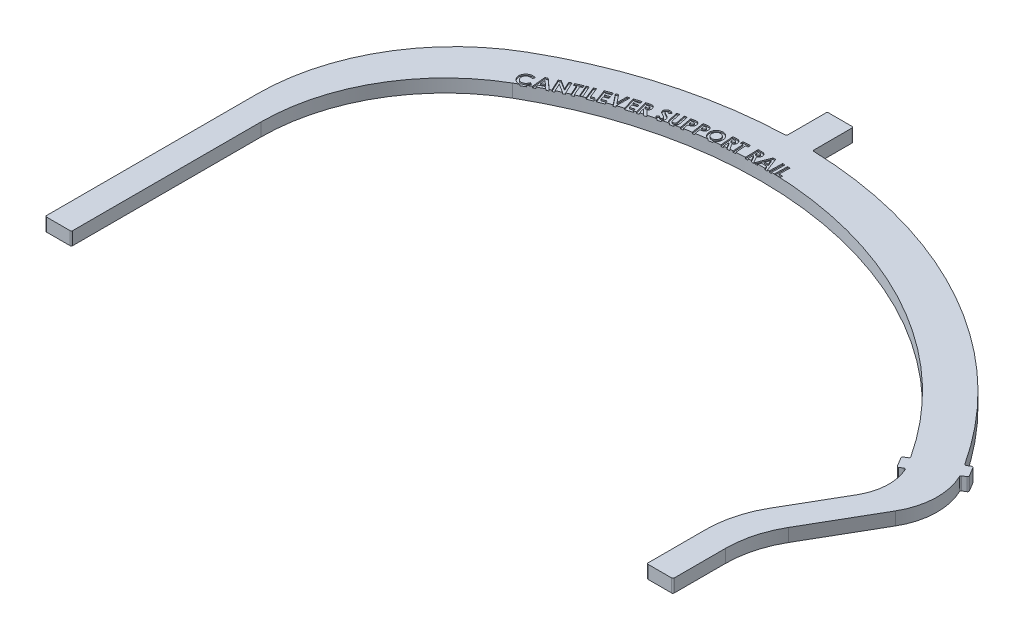
from build123d import *

# Parameters (mm, degrees)
BOSS_EXTRUDE1_DEPTH = 12.7
FILLET1_R           = 1.27
CUT_EXTRUDE1_DEPTH  = 1.27


with BuildPart() as part:
    # Sketch1 → Boss-Extrude1 (new body)
    with BuildSketch(Plane(origin=(0, 0, 0), x_dir=(1, 0, 0), z_dir=(0, 1, 0))):
        with BuildLine():
            Line((12.7, 417.636946282), (12.7, 457.2))
            Line((12.7, 457.2), (-12.7, 457.2))
            Line((-12.7, 457.2), (-12.7, 417.636946282))
            ThreePointArc((-12.7, 417.636946282), (-114.264207012, 401.902475603), (-208.915, 361.851394463))
            ThreePointArc((-208.915, 361.851394463), (-279.107691684, 291.65870278), (-304.8, 195.77370278))
            Line((-304.8, 195.77370278), (-304.8, -10.16))
            Line((-304.8, -10.16), (-279.4, -10.16))
            Line((-279.4, -10.16), (-279.4, 173.776657523))
            ThreePointArc((-279.4, 173.776657523), (-255.409169056, 263.311657523), (-189.865, 328.855826579))
            ThreePointArc((-189.865, 328.855826579), (88.781385623, 369.205550428), (318.619726062, 206.582533299))
            Line((318.619726062, 206.582533299), (313.181667761, 203.303810694))
            Line((313.181667761, 203.303810694), (319.739112972, 192.427694094))
            Line((319.739112972, 192.427694094), (325.177171273, 195.706416699))
            ThreePointArc((325.177171273, 195.706416699), (330.124805237, 172.660298346), (323.643063584, 149.997781316))
            Line((323.643063584, 149.997781316), (292.47627178, 96.015314403))
            ThreePointArc((292.47627178, 96.015314403), (282.725728673, 72.475420994), (279.4, 47.214003746))
            Line((279.4, 47.214003746), (279.4, -10.16))
            Line((279.4, -10.16), (304.8, -10.16))
            Line((304.8, -10.16), (304.8, 40.64))
            ThreePointArc((304.8, 40.64), (308.096238021, 65.677413503), (317.760318909, 89.008568651))
            Line((317.760318909, 89.008568651), (355.860318909, 154.99970442))
            ThreePointArc((355.860318909, 154.99970442), (364.399518175, 185.242382465), (357.491909189, 215.898906038))
            Line((357.491909189, 215.898906038), (362.929967489, 219.177628643))
            Line((362.929967489, 219.177628643), (356.372522278, 230.053745244))
            Line((356.372522278, 230.053745244), (350.934463978, 226.775022638))
            ThreePointArc((350.934463978, 226.775022638), (205.340142988, 363.891927057), (12.7, 417.636946282))
        make_face()
    extrude(amount=BOSS_EXTRUDE1_DEPTH)

    # Fillet1
    fillet1_edges = [part.edges().sort_by_distance(p)[0] for p in [
        (-279.4, 6.35, 10.16),
        (-304.8, 6.35, 10.16),
        (-12.7, 6.35, -417.636946282),
        (-12.7, 6.35, -457.2),
        (12.7, 6.35, -457.2),
        (12.7, 6.35, -417.636946282),
        (350.934463978, 6.35, -226.775022638),
        (356.372522278, 6.35, -230.053745244),
        (362.929967489, 6.35, -219.177628643),
        (357.491909189, 6.35, -215.898906038),
        (304.8, 6.35, 10.16),
        (279.4, 6.35, 10.16),
        (325.177171273, 6.35, -195.706416699),
        (319.739112972, 6.35, -192.427694094),
        (313.181667761, 6.35, -203.303810694),
        (318.619726062, 6.35, -206.582533299),
    ]]
    fillet(fillet1_edges, radius=FILLET1_R)

    # Sketch2 → Cut-Extrude1 (cut)
    # profile 1 of 21: a face of its own
    with BuildSketch(Plane(origin=(0, 12.7, 0), x_dir=(1, 0, 0), z_dir=(0, 1, 0))):
        with BuildLine():
            Line((-183.436133814, 344.349216002), (-184.138297276, 342.118066162))
            add(Edge.make_bspline(
                [(-184.138297276, 342.118066162), (-184.334208247, 342.174776719), (-184.717447153, 342.285713291), (-185.293816958, 342.393164695), (-185.854500385, 342.442572779), (-186.400124144, 342.435519598), (-186.930865296, 342.372499098), (-187.445150299, 342.25188818), (-187.944411901, 342.076670827), (-188.25877982, 341.916502439), (-188.417423878, 341.835674335)],
                knots=[0, 0, 0, 0, 1.108668656, 2.168765531, 3.182528913, 4.164925455, 5.131069748, 6.083032415, 7.032612752, 8, 8, 8, 8], degree=3))
            add(Edge.make_bspline(
                [(-188.417423878, 341.835674335), (-188.546107628, 341.759960844), (-188.798674867, 341.611358184), (-189.147549449, 341.351715891), (-189.460646776, 341.066641908), (-189.741194255, 340.756339827), (-189.985399108, 340.420008556), (-190.195180584, 340.058272654), (-190.371810553, 339.672678564), (-190.509357898, 339.265619422), (-190.612010909, 338.847901197), (-190.670505642, 338.427652985), (-190.686738191, 338.010712011), (-190.657097585, 337.59752516), (-190.589985535, 337.185906126), (-190.472680505, 336.778769558), (-190.318539427, 336.372976284), (-190.18317029, 336.113660927), (-190.11431891, 335.981768085)],
                knots=[0, 0, 0, 0, 1.053669127, 2.068033471, 3.064135552, 4.03930225, 5.016635864, 5.99332725, 6.987429577, 8.006185167, 9.022809227, 10.020368059, 10.997059445, 11.963361478, 12.940878509, 13.936116325, 14.950268562, 16, 16, 16, 16], degree=3))
            add(Edge.make_bspline(
                [(-190.11431891, 335.981768085), (-190.063087464, 335.891040779), (-189.961984562, 335.71199461), (-189.788365539, 335.460444721), (-189.610805994, 335.220827804), (-189.416661259, 335.001600376), (-189.217406645, 334.793864401), (-189.002209291, 334.606242361), (-188.778171846, 334.432567752), (-188.544545064, 334.275201664), (-188.303013295, 334.134351221), (-188.052374928, 334.014825833), (-187.79621167, 333.913790833), (-187.534774942, 333.82853928), (-187.266889504, 333.762723145), (-186.992511217, 333.713703657), (-186.711767571, 333.686669412), (-186.331918014, 333.672801449), (-185.852950613, 333.701924676), (-185.285063146, 333.81664501), (-184.723908573, 334.000731594), (-184.371030557, 334.182390491), (-184.191722756, 334.274696771)],
                knots=[0, 0, 0, 0, 0.904477809, 1.784945369, 2.652596305, 3.493060883, 4.32642761, 5.150959464, 5.970078434, 6.787208121, 7.595728123, 8.396257636, 9.196380444, 9.985992823, 10.782718355, 11.590399209, 12.404635804, 13.230088261, 14.890511674, 16.557440406, 18.250733226, 20, 20, 20, 20], degree=3))
            add(Edge.make_bspline(
                [(-184.191722756, 334.274696771), (-184.043919464, 334.361604334), (-183.752580101, 334.532910355), (-183.355515841, 334.837445219), (-183.001049053, 335.172823675), (-182.74041744, 335.481036542), (-182.554035437, 335.751032106), (-182.415775744, 335.971336514), (-182.287684677, 336.21524771), (-182.158900993, 336.476049013), (-182.042024594, 336.759753216), (-181.922247667, 337.060144608), (-181.814991558, 337.383999065), (-181.746438788, 337.607301899), (-181.711254006, 337.721912316)],
                knots=[0, 0, 0, 0, 1.409382844, 2.778075459, 4.105398876, 5.417456718, 6.088945294, 6.803238793, 7.5553943, 8.354082489, 9.194945576, 10.078421385, 11.013747733, 12, 12, 12, 12], degree=3))
            Line((-181.711254006, 337.721912316), (-179.449575321, 337.019748855))
            add(Edge.make_bspline(
                [(-179.449575321, 337.019748855), (-179.497711614, 336.866756894), (-179.59182042, 336.567650135), (-179.747428288, 336.134978907), (-179.909966838, 335.72750249), (-180.079881837, 335.344836793), (-180.260066115, 334.987785061), (-180.451684547, 334.657974849), (-180.646585841, 334.350313031), (-180.85483075, 334.067920645), (-181.077046325, 333.80403857), (-181.310557025, 333.54771448), (-181.565595589, 333.304023906), (-181.838931057, 333.070867784), (-182.126200971, 332.842076474), (-182.435209323, 332.62836049), (-182.75801445, 332.416745711), (-182.985047371, 332.2890232), (-183.100316506, 332.224175938)],
                knots=[0, 0, 0, 0, 1.239492818, 2.423269025, 3.552726668, 4.629475398, 5.658320836, 6.641999771, 7.576499069, 8.471839977, 9.351302899, 10.241905312, 11.150462914, 12.075351284, 13.018111434, 13.987294112, 14.978109132, 16, 16, 16, 16], degree=3))
            add(Edge.make_bspline(
                [(-183.100316506, 332.224175938), (-183.314761457, 332.112655985), (-183.734970966, 331.894130231), (-184.384153411, 331.637211849), (-185.031771167, 331.445531867), (-185.679965736, 331.326193793), (-186.326811006, 331.271898923), (-186.972354171, 331.284126227), (-187.617042971, 331.36647788), (-188.253957248, 331.517041623), (-188.873646914, 331.72590881), (-189.461740515, 331.998255257), (-190.016914659, 332.323550253), (-190.533699784, 332.71128822), (-191.013718279, 333.15629234), (-191.456673002, 333.659067396), (-191.870988799, 334.21384858), (-192.106068227, 334.619820338), (-192.225897436, 334.826760073)],
                knots=[0, 0, 0, 0, 1.089117141, 2.134148544, 3.141927206, 4.12948818, 5.100067623, 6.063687251, 7.034853834, 8.024336998, 9.009675401, 9.977887629, 10.941082454, 11.905278301, 12.88462788, 13.886639386, 14.922737172, 16, 16, 16, 16], degree=3))
            add(Edge.make_bspline(
                [(-192.225897436, 334.826760073), (-192.298637994, 334.965081838), (-192.442244958, 335.238161525), (-192.628718062, 335.655384409), (-192.781534574, 336.075042346), (-192.906379971, 336.495577368), (-193.004815088, 336.917398095), (-193.067064369, 337.342133183), (-193.1037708, 337.766937013), (-193.108749561, 338.192951393), (-193.082843925, 338.617046884), (-193.029387742, 339.037747367), (-192.948043547, 339.454506132), (-192.835969968, 339.86579595), (-192.694510247, 340.272387345), (-192.527308489, 340.675184333), (-192.32741216, 341.071948736), (-192.102353517, 341.462428558), (-191.851561189, 341.839616659), (-191.579004374, 342.199201933), (-191.285741237, 342.53816163), (-190.973034396, 342.856931073), (-190.638168703, 343.152644268), (-190.283683278, 343.427647737), (-189.909577496, 343.683704706), (-189.646406884, 343.8353119), (-189.513918269, 343.911635874)],
                knots=[0, 0, 0, 0, 1.063353785, 2.099310389, 3.107092255, 4.10039494, 5.083147309, 6.05192315, 7.019047492, 7.982860345, 8.948330362, 9.908213332, 10.866829083, 11.835587735, 12.806509757, 13.794669332, 14.801194653, 15.827656348, 16.860022271, 17.881491522, 18.896156572, 19.908192441, 20.917971633, 21.933801203, 22.959808568, 24, 24, 24, 24], degree=3))
            add(Edge.make_bspline(
                [(-189.513918269, 343.911635874), (-189.399382948, 343.973455773), (-189.171221021, 344.096605098), (-188.815177741, 344.25239419), (-188.454258643, 344.393612304), (-188.085420719, 344.5129133), (-187.710533052, 344.611225499), (-187.330036439, 344.695237897), (-186.941212323, 344.751212961), (-186.547512883, 344.792847872), (-186.150910787, 344.813704872), (-185.755137463, 344.810491615), (-185.362002115, 344.787581302), (-184.971143679, 344.744825166), (-184.583193991, 344.678190922), (-184.196656278, 344.591436701), (-183.813465773, 344.482936159), (-183.562039935, 344.393835033), (-183.436133814, 344.349216002)],
                knots=[0, 0, 0, 0, 0.993707947, 1.97953189, 2.96586638, 3.953157434, 4.938236355, 5.92533617, 6.927473271, 7.936764488, 8.948525925, 9.958980351, 10.958161691, 11.955262473, 12.960471858, 13.963006587, 14.979938019, 16, 16, 16, 16], degree=3))
        make_face()
    # profile 2 of 21: a face of its own
    with BuildSketch(Plane(origin=(0, 12.7, 0), x_dir=(1, 0, 0), z_dir=(0, 1, 0))):
        Polygon((-178.922355153, 349.103141408), (-176.754807076, 350.207268011), (-166.710816691, 341.183449902), (-168.931790249, 340.051338524), (-170.987399223, 341.91614221), (-175.566726146, 339.580685479), (-175.304686884, 336.802560479), (-177.525660441, 335.670449101), align=None)
        Polygon((-176.304506595, 346.686274421), (-175.836397621, 342.068786441), (-172.852202909, 343.590140607), align=None, mode=Mode.SUBTRACT)
    # profile 3 of 21: a face of its own
    with BuildSketch(Plane(origin=(0, 12.7, 0), x_dir=(1, 0, 0), z_dir=(0, 1, 0))):
        Polygon((-170.314195296, 353.457642666), (-168.228057475, 354.432021673), (-159.794463725, 349.181060134), (-163.310369174, 356.724229205), (-161.130100745, 357.73931334), (-155.787552668, 346.278275679), (-157.88386677, 345.301352602), (-166.294563886, 350.531961577), (-162.791378789, 343.014233211), (-164.971647219, 341.996605006), align=None)
    # profile 4 of 21: a face of its own
    with BuildSketch(Plane(origin=(0, 12.7, 0), x_dir=(1, 0, 0), z_dir=(0, 1, 0))):
        Polygon((-159.340600838, 358.54246818), (-152.942263498, 361.325681321), (-151.995869268, 359.153045103), (-154.104903723, 358.234635648), (-150.014038338, 348.829206962), (-152.247732248, 347.857372026), (-156.338597633, 357.262800712), (-158.394206607, 356.369831962), align=None)
    # profile 5 of 21: a face of its own
    with BuildSketch(Plane(origin=(0, 12.7, 0), x_dir=(1, 0, 0), z_dir=(0, 1, 0))):
        Polygon((-151.634667131, 361.885834877), (-149.44676649, 362.837317249), (-144.409506875, 351.259252345), (-146.597407516, 350.307769974), align=None)
    # profile 6 of 21: a face of its own
    with BuildSketch(Plane(origin=(0, 12.7, 0), x_dir=(1, 0, 0), z_dir=(0, 1, 0))):
        Polygon((-146.545744901, 363.897365784), (-144.319683202, 364.777614182), (-140.529018138, 355.204276842), (-137.285328234, 356.489032451), (-136.445784965, 354.367277643), (-141.915536567, 352.202273637), align=None)
    # profile 7 of 21: a face of its own
    with BuildSketch(Plane(origin=(0, 12.7, 0), x_dir=(1, 0, 0), z_dir=(0, 1, 0))):
        Polygon((-138.997336809, 366.860338773), (-132.548118059, 369.246676914), (-131.734015495, 367.04605592), (-135.949540335, 365.486540696), (-135.158334405, 363.349521465), (-130.942809565, 364.909036689), (-130.143971424, 362.749120824), (-134.359496264, 361.1896056), (-133.209576392, 358.083295503), (-128.994051552, 359.642810728), (-128.177404918, 357.434557523), (-134.626623668, 355.048219382), align=None)
    # profile 8 of 21: a face of its own
    with BuildSketch(Plane(origin=(0, 12.7, 0), x_dir=(1, 0, 0), z_dir=(0, 1, 0))):
        Polygon((-131.013741447, 369.793766237), (-128.678284716, 370.582428096), (-122.811658113, 363.123213352), (-122.638661318, 372.627860788), (-120.303204588, 373.419066718), (-120.56269978, 360.03471175), (-122.753144491, 359.294387231), align=None)
    # profile 9 of 21: a face of its own
    with BuildSketch(Plane(origin=(0, 12.7, 0), x_dir=(1, 0, 0), z_dir=(0, 1, 0))):
        Polygon((-118.029573282, 374.142448137), (-111.453151006, 376.164984195), (-110.763707897, 373.921114003), (-115.063187064, 372.600741407), (-114.394096519, 370.423017048), (-110.094617352, 371.743389644), (-109.415350525, 369.54022458), (-113.714829692, 368.219851984), (-112.740450686, 365.049940125), (-108.440971519, 366.370312721), (-107.748984339, 364.118810317), (-114.325406615, 362.096274259), align=None)
    # profile 10 of 21: a face of its own
    with BuildSketch(Plane(origin=(0, 12.7, 0), x_dir=(1, 0, 0), z_dir=(0, 1, 0))):
        with BuildLine():
            Line((-108.841255093, 376.941196229), (-106.386227048, 377.625551197))
            add(Edge.make_bspline(
                [(-106.386227048, 377.625551197), (-106.223584659, 377.669467283), (-105.911020777, 377.753864605), (-105.456880893, 377.865051895), (-105.034844053, 377.950835558), (-104.646556788, 378.018562997), (-104.29073504, 378.062362721), (-103.96893946, 378.085746536), (-103.678941448, 378.090832396), (-103.417777272, 378.069647033), (-103.176333461, 378.0307414), (-102.945279667, 377.975182887), (-102.722382613, 377.897749129), (-102.504291034, 377.806094), (-102.293159841, 377.696632015), (-102.087848149, 377.568546421), (-101.890881978, 377.420711218), (-101.698974045, 377.257483693), (-101.517100157, 377.078717364), (-101.349077529, 376.883856571), (-101.192354207, 376.677791147), (-101.052708522, 376.454783492), (-100.925310328, 376.217621763), (-100.811013962, 375.966222148), (-100.711593486, 375.7007302), (-100.65678022, 375.517705223), (-100.628995478, 375.424930203)],
                knots=[0, 0, 0, 0, 1.7091728, 3.284664515, 4.742510489, 6.077731767, 7.28254219, 8.377938886, 9.350183102, 10.221867747, 11.032342763, 11.829464723, 12.629367673, 13.423559113, 14.227799613, 15.039461068, 15.875737508, 16.724010014, 17.593994639, 18.460013817, 19.332419968, 20.217963476, 21.126406882, 22.062025503, 23.017644339, 24, 24, 24, 24], degree=3))
            add(Edge.make_bspline(
                [(-100.628995478, 375.424930203), (-100.60283065, 375.326910646), (-100.551338866, 375.134010397), (-100.502489677, 374.844401994), (-100.46976464, 374.562474881), (-100.462937631, 374.28760719), (-100.475311318, 374.019731965), (-100.507869851, 373.758234468), (-100.564007165, 373.504688028), (-100.640846028, 373.258810668), (-100.738106413, 373.020196333), (-100.857898586, 372.788484791), (-101.000271348, 372.564649745), (-101.166361037, 372.350035379), (-101.347538849, 372.137955043), (-101.555779286, 371.936986053), (-101.785312443, 371.743516452), (-101.949513997, 371.622337024), (-102.033322401, 371.560487094)],
                knots=[0, 0, 0, 0, 1.098652321, 2.162122676, 3.178838257, 4.171563492, 5.137434116, 6.082227699, 7.023036399, 7.947185891, 8.8702842, 9.811362074, 10.769774127, 11.740092375, 12.749683256, 13.789308294, 14.871663883, 16, 16, 16, 16], degree=3))
            Line((-102.033322401, 371.560487094), (-97.647344837, 366.953175396))
            Line((-97.647344837, 366.953175396), (-100.178694997, 366.248467864))
            Line((-100.178694997, 366.248467864), (-104.353514708, 370.634445428))
            Line((-104.353514708, 370.634445428), (-104.567216631, 370.575931806))
            Line((-104.567216631, 370.575931806), (-103.129816792, 365.424189017))
            Line((-103.129816792, 365.424189017), (-105.444920958, 364.777995107))
            Line((-105.444920958, 364.777995107), (-108.841255093, 376.941196229))
        make_face()
        with BuildLine():
            Line((-105.198146119, 372.832522351), (-104.470541952, 373.036047992))
            add(Edge.make_bspline(
                [(-104.470541952, 373.036047992), (-104.38214134, 373.061677315), (-104.21208261, 373.110981159), (-103.971037458, 373.192337317), (-103.753397772, 373.274692181), (-103.562837753, 373.365288439), (-103.39297277, 373.453105533), (-103.246877372, 373.546161941), (-103.127392698, 373.64631555), (-102.997113698, 373.776792449), (-102.87773543, 373.96644062), (-102.807036751, 374.229451651), (-102.803300387, 374.523736731), (-102.850372364, 374.721750815), (-102.87540974, 374.827073633)],
                knots=[0, 0, 0, 0, 1.199584218, 2.307673692, 3.315575945, 4.230444481, 5.056234097, 5.80740779, 6.482507346, 7.084409302, 8.206905447, 9.35480357, 10.593031686, 12, 12, 12, 12], degree=3))
            add(Edge.make_bspline(
                [(-102.87540974, 374.827073633), (-102.895442526, 374.890646525), (-102.934555786, 375.014770208), (-103.026032455, 375.183629472), (-103.135776318, 375.335221782), (-103.271539793, 375.460904735), (-103.422538587, 375.565638723), (-103.586109785, 375.649235889), (-103.763833311, 375.701285659), (-103.921035705, 375.72644386), (-104.058453071, 375.728686923), (-104.180020813, 375.72370217), (-104.317415157, 375.707447327), (-104.472796584, 375.684360313), (-104.644283536, 375.651428194), (-104.832974955, 375.606913136), (-105.039127667, 375.556289926), (-105.182093124, 375.518446353), (-105.25665974, 375.498708248)],
                knots=[0, 0, 0, 0, 1.129414846, 2.20514004, 3.244794908, 4.293978986, 5.328535761, 6.358875165, 7.397432561, 8.46045781, 9.051010054, 9.728395773, 10.525063076, 11.398694482, 12.395588622, 13.488902812, 14.690284881, 16, 16, 16, 16], degree=3))
            Line((-105.25665974, 375.498708248), (-105.892677369, 375.320623312))
            Line((-105.892677369, 375.320623312), (-105.198146119, 372.832522351))
        make_face(mode=Mode.SUBTRACT)
    # profile 11 of 21: a face of its own
    with BuildSketch(Plane(origin=(0, 12.7, 0), x_dir=(1, 0, 0), z_dir=(0, 1, 0))):
        with BuildLine():
            Line((-87.07234762, 380.797274758), (-88.435969414, 378.858693027))
            add(Edge.make_bspline(
                [(-88.435969414, 378.858693027), (-88.53488271, 378.941547159), (-88.724354478, 379.100257056), (-89.015421102, 379.305871962), (-89.298753561, 379.468688428), (-89.57181908, 379.598619577), (-89.84100005, 379.678115161), (-90.100012127, 379.728232889), (-90.35259074, 379.731794276), (-90.513917924, 379.702487894), (-90.593341209, 379.688060014)],
                knots=[0, 0, 0, 0, 1.29104791, 2.473045985, 3.560491686, 4.559307864, 5.490922244, 6.361628639, 7.193410348, 8, 8, 8, 8], degree=3))
            add(Edge.make_bspline(
                [(-90.593341209, 379.688060014), (-90.665181064, 379.667049133), (-90.804023976, 379.626441982), (-90.996797291, 379.536315758), (-91.15559337, 379.409975843), (-91.28839609, 379.267684457), (-91.383081274, 379.110288507), (-91.448805681, 378.953196584), (-91.471398766, 378.792223137), (-91.454197117, 378.688946132), (-91.445604831, 378.637358892)],
                knots=[0, 0, 0, 0, 1.201910792, 2.322899922, 3.390994857, 4.442014584, 5.432592519, 6.325539356, 7.163600814, 8, 8, 8, 8], degree=3))
            add(Edge.make_bspline(
                [(-91.445604831, 378.637358892), (-91.431675574, 378.586426221), (-91.403864272, 378.484733509), (-91.321970437, 378.346619076), (-91.224513286, 378.214072303), (-91.140192113, 378.140653272), (-91.097067171, 378.103104085)],
                knots=[0, 0, 0, 0, 0.971651706, 1.940010096, 2.946445558, 4, 4, 4, 4], degree=3))
            add(Edge.make_bspline(
                [(-91.097067171, 378.103104085), (-91.059186658, 378.074721543), (-90.971789275, 378.009237747), (-90.8149253, 377.908281118), (-90.616652172, 377.789742014), (-90.376814803, 377.651972839), (-90.094159804, 377.497170744), (-89.768901817, 377.325005662), (-89.402573115, 377.134143211), (-89.144168671, 377.00217617), (-89.00838528, 376.932831649)],
                knots=[0, 0, 0, 0, 0.473928431, 1.093440952, 1.866850076, 2.787531435, 3.863210496, 5.094175802, 6.47308097, 8, 8, 8, 8], degree=3))
            add(Edge.make_bspline(
                [(-89.00838528, 376.932831649), (-88.881087975, 376.869416039), (-88.639730265, 376.749179037), (-88.298305769, 376.575524219), (-87.995411126, 376.420612624), (-87.730974832, 376.282964311), (-87.504533788, 376.164946336), (-87.319484158, 376.061300047), (-87.170178975, 375.982627748), (-87.087368557, 375.930036317), (-87.051995055, 375.907571232)],
                knots=[0, 0, 0, 0, 1.544947196, 2.929244406, 4.161144307, 5.240673204, 6.167870374, 6.934706661, 7.544946679, 8, 8, 8, 8], degree=3))
            add(Edge.make_bspline(
                [(-87.051995055, 375.907571232), (-86.913246333, 375.817105763), (-86.647419694, 375.6437843), (-86.285692348, 375.362476573), (-85.976823123, 375.07683663), (-85.719020036, 374.781730421), (-85.506373692, 374.47186026), (-85.327722871, 374.14337453), (-85.183134546, 373.789193707), (-85.116680571, 373.540737822), (-85.082884478, 373.41438213)],
                knots=[0, 0, 0, 0, 1.215631884, 2.329011269, 3.359757307, 4.299774952, 5.199509498, 6.113265172, 7.040474788, 8, 8, 8, 8], degree=3))
            add(Edge.make_bspline(
                [(-85.082884478, 373.41438213), (-85.056811471, 373.290118183), (-85.005703761, 373.046538851), (-84.969851117, 372.67996515), (-84.972548811, 372.321944343), (-85.010488361, 371.972357711), (-85.08432117, 371.63083526), (-85.197200008, 371.299320866), (-85.346512417, 370.976789841), (-85.528366367, 370.664857418), (-85.744214135, 370.371585787), (-85.986896099, 370.099573139), (-86.257381754, 369.855055599), (-86.555523165, 369.636437133), (-86.88213422, 369.446635128), (-87.235384825, 369.280855666), (-87.614593672, 369.139535388), (-87.880645691, 369.070970316), (-88.01619778, 369.036036777)],
                knots=[0, 0, 0, 0, 1.030501675, 2.019965693, 2.984086989, 3.933162525, 4.870574013, 5.815693903, 6.770895623, 7.752371424, 8.742697761, 9.722916499, 10.707744649, 11.698070987, 12.719698822, 13.770163422, 14.863910127, 16, 16, 16, 16], degree=3))
            add(Edge.make_bspline(
                [(-88.01619778, 369.036036777), (-88.124510024, 369.012813689), (-88.337548328, 368.967136421), (-88.657670548, 368.919590087), (-88.972466625, 368.901031725), (-89.281023945, 368.899481654), (-89.583806368, 368.922954701), (-89.880746018, 368.968242059), (-90.17252459, 369.03740098), (-90.458071913, 369.129762112), (-90.740292835, 369.243274667), (-91.014958736, 369.389469509), (-91.290348248, 369.552000476), (-91.557345956, 369.747035888), (-91.826526531, 369.958796344), (-92.086561009, 370.202933201), (-92.34803792, 370.467073648), (-92.513497116, 370.658158611), (-92.598068773, 370.755828444)],
                knots=[0, 0, 0, 0, 1.02350417, 2.013120451, 2.98681727, 3.934985661, 4.862331354, 5.789941871, 6.707970615, 7.629837359, 8.561147498, 9.5144505, 10.502203563, 11.513334089, 12.567020371, 13.665025822, 14.806517613, 16, 16, 16, 16], degree=3))
            Line((-92.598068773, 370.755828444), (-90.921526305, 372.409474277))
            add(Edge.make_bspline(
                [(-90.921526305, 372.409474277), (-90.818288205, 372.298163239), (-90.620609153, 372.085026222), (-90.30669058, 371.809421657), (-89.9972416, 371.585047258), (-89.691706552, 371.410469941), (-89.385564578, 371.29450912), (-89.084797867, 371.229664674), (-88.785863608, 371.21176576), (-88.593348262, 371.248704877), (-88.497027107, 371.267186617)],
                knots=[0, 0, 0, 0, 1.293895762, 2.477535792, 3.555199485, 4.549032581, 5.469013332, 6.33415948, 7.166530424, 8, 8, 8, 8], degree=3))
            add(Edge.make_bspline(
                [(-88.497027107, 371.267186617), (-88.400943963, 371.294620586), (-88.215005537, 371.347710327), (-87.960049872, 371.476797423), (-87.743582019, 371.647518313), (-87.565968346, 371.850859005), (-87.432209154, 372.073527616), (-87.347446385, 372.304596264), (-87.314701503, 372.53980378), (-87.341393465, 372.692060073), (-87.354739446, 372.768188219)],
                knots=[0, 0, 0, 0, 1.147331348, 2.220295649, 3.262137253, 4.298853815, 5.309084779, 6.231467136, 7.115733568, 8, 8, 8, 8], degree=3))
            add(Edge.make_bspline(
                [(-87.354739446, 372.768188219), (-87.375234275, 372.836970725), (-87.41701921, 372.977204765), (-87.527608672, 373.175309601), (-87.677797727, 373.361696486), (-87.833319441, 373.507670169), (-87.984907067, 373.624652608), (-88.126860643, 373.722885276), (-88.295179847, 373.829316871), (-88.489201196, 373.944323747), (-88.711518285, 374.065657207), (-88.959709482, 374.197687149), (-89.234591826, 374.33747334), (-89.427168054, 374.431447791), (-89.527375664, 374.480347674)],
                knots=[0, 0, 0, 0, 0.904143518, 1.843371304, 2.841778968, 3.917423191, 4.527893781, 5.258656167, 6.09637596, 7.042173554, 8.10618827, 9.29418928, 10.592023381, 12, 12, 12, 12], degree=3))
            add(Edge.make_bspline(
                [(-89.527375664, 374.480347674), (-89.718634149, 374.5735769), (-90.086850792, 374.753064636), (-90.609167014, 375.025616117), (-91.084035972, 375.282144662), (-91.508627012, 375.525690512), (-91.884513597, 375.755717081), (-92.206996621, 375.978105122), (-92.483917866, 376.181904818), (-92.778626073, 376.436107048), (-93.079978714, 376.756632432), (-93.37126943, 377.159671781), (-93.596774071, 377.579188882), (-93.68101571, 377.877276703), (-93.72254794, 378.024237899)],
                knots=[0, 0, 0, 0, 1.349798944, 2.598673907, 3.737374327, 4.773711875, 5.703851128, 6.532061878, 7.25836646, 7.883932784, 8.999106239, 10.039805631, 11.033598534, 12, 12, 12, 12], degree=3))
            add(Edge.make_bspline(
                [(-93.72254794, 378.024237899), (-93.743997768, 378.12990934), (-93.786288603, 378.338252898), (-93.815363393, 378.652961622), (-93.805812703, 378.963199262), (-93.769922817, 379.270033136), (-93.692882214, 379.57171039), (-93.590125176, 379.871377758), (-93.447567705, 380.163804338), (-93.27800026, 380.450075), (-93.082935681, 380.72309173), (-92.858812673, 380.970541193), (-92.61713701, 381.195696275), (-92.353237374, 381.395656043), (-92.067269571, 381.56887197), (-91.759833642, 381.715642736), (-91.434220714, 381.843178829), (-91.205500752, 381.902053685), (-91.089434959, 381.931930206)],
                knots=[0, 0, 0, 0, 0.986364507, 1.944732539, 2.884058249, 3.822582144, 4.76558742, 5.727718692, 6.717009741, 7.736522416, 8.770407112, 9.781615496, 10.786580595, 11.789265769, 12.806116604, 13.840467224, 14.904127638, 16, 16, 16, 16], degree=3))
            add(Edge.make_bspline(
                [(-91.089434959, 381.931930206), (-90.936504431, 381.962970365), (-90.632749152, 382.024623276), (-90.167268322, 382.047799257), (-89.701402619, 382.016490056), (-89.311680201, 381.946425834), (-88.997288819, 381.852740255), (-88.748415022, 381.768872323), (-88.492931245, 381.655571579), (-88.225586984, 381.52806681), (-87.951726705, 381.371803525), (-87.663577135, 381.204605334), (-87.370776295, 381.007961936), (-87.173817646, 380.868911418), (-87.07234762, 380.797274758)],
                knots=[0, 0, 0, 0, 1.298221556, 2.578567241, 3.866817388, 5.181458282, 5.865436023, 6.598080011, 7.366905377, 8.191368143, 9.063979846, 9.991839064, 10.965426775, 12, 12, 12, 12], degree=3))
        make_face()
    # profile 12 of 21: a face of its own
    with BuildSketch(Plane(origin=(0, 12.7, 0), x_dir=(1, 0, 0), z_dir=(0, 1, 0))):
        with BuildLine():
            Line((-84.792401988, 383.109952979), (-82.423872341, 383.6085908))
            Line((-82.423872341, 383.6085908), (-80.73460952, 375.584592402))
            add(Edge.make_bspline(
                [(-80.73460952, 375.584592402), (-80.716225918, 375.501425414), (-80.680884383, 375.34154113), (-80.625594418, 375.112107259), (-80.567197205, 374.903314098), (-80.506724631, 374.714647259), (-80.442842128, 374.546955228), (-80.379501533, 374.397854777), (-80.314756032, 374.26902768), (-80.22579366, 374.125404277), (-80.10216086, 373.969359838), (-79.922989557, 373.817663166), (-79.724663721, 373.686444854), (-79.500844122, 373.589100821), (-79.256994254, 373.521018862), (-78.996801798, 373.495426854), (-78.722141584, 373.502343748), (-78.537941926, 373.534961841), (-78.442401988, 373.551880062)],
                knots=[0, 0, 0, 0, 1.156314375, 2.2229553, 3.203420597, 4.099038668, 4.911554176, 5.63867303, 6.297712778, 6.866393232, 7.930795141, 8.983489994, 10.040456962, 11.148600708, 12.282518684, 13.463612622, 14.684436789, 16, 16, 16, 16], degree=3))
            add(Edge.make_bspline(
                [(-78.442401988, 373.551880062), (-78.342417612, 373.576474899), (-78.147829697, 373.624340958), (-77.875376811, 373.736831365), (-77.634368999, 373.883085443), (-77.424784472, 374.056699648), (-77.248565733, 374.252034924), (-77.111313984, 374.464071598), (-77.007628819, 374.686709353), (-76.95870522, 374.887045137), (-76.938906905, 375.06261881), (-76.93409396, 375.219164492), (-76.943288439, 375.399163758), (-76.961427726, 375.60363785), (-76.989665626, 375.831850737), (-77.028334819, 376.083710842), (-77.076292881, 376.3596393), (-77.116336082, 376.550608737), (-77.137293815, 376.650557947)],
                knots=[0, 0, 0, 0, 1.26861608, 2.468959331, 3.618708017, 4.732846711, 5.814202095, 6.849829164, 7.83744712, 8.829264904, 9.376728033, 10.015054325, 10.758287836, 11.598184358, 12.54647599, 13.593709292, 14.740600271, 16, 16, 16, 16], degree=3))
            Line((-77.137293815, 376.650557947), (-78.765498943, 384.379444165))
            Line((-78.765498943, 384.379444165), (-76.396969296, 384.878081986))
            Line((-76.396969296, 384.878081986), (-74.839998142, 377.487557146))
            add(Edge.make_bspline(
                [(-74.839998142, 377.487557146), (-74.808756706, 377.337595431), (-74.748678483, 377.049214531), (-74.673664437, 376.632371008), (-74.608428739, 376.251084246), (-74.560544616, 375.903940572), (-74.523536774, 375.591121147), (-74.50245398, 375.311860104), (-74.496940256, 375.067264893), (-74.506093288, 374.786110964), (-74.552825424, 374.454228864), (-74.659641404, 374.062269558), (-74.813639072, 373.666950631), (-75.012476165, 373.274646139), (-75.251678038, 372.899556499), (-75.523287135, 372.553127969), (-75.831760501, 372.248347768), (-76.172614527, 371.980926666), (-76.551371454, 371.753720103), (-76.967319304, 371.559578402), (-77.423087502, 371.39841344), (-77.745310831, 371.323541232), (-77.910691251, 371.285113236)],
                knots=[0, 0, 0, 0, 1.154422225, 2.219988754, 3.191908241, 4.069567057, 4.860773218, 5.565673403, 6.179371645, 6.703809131, 7.684514981, 8.696886106, 9.759169916, 10.876771106, 12.00617062, 13.107145639, 14.187275876, 15.266346678, 16.36464708, 17.508315378, 18.721148306, 20, 20, 20, 20], degree=3))
            add(Edge.make_bspline(
                [(-77.910691251, 371.285113236), (-78.021528807, 371.263226907), (-78.240448246, 371.219998392), (-78.56789574, 371.182694437), (-78.888301621, 371.167253418), (-79.201852871, 371.172440907), (-79.509842304, 371.196682752), (-79.810570167, 371.246127889), (-80.104448405, 371.313829537), (-80.388669329, 371.406271318), (-80.66160727, 371.515655006), (-80.922223539, 371.63617229), (-81.163570941, 371.775369169), (-81.392424145, 371.923150778), (-81.606343941, 372.085014015), (-81.801459433, 372.263592886), (-81.981700736, 372.454065908), (-82.150659173, 372.660773844), (-82.309584147, 372.897164425), (-82.454815257, 373.175252972), (-82.600794106, 373.492790016), (-82.735688122, 373.856290011), (-82.870909334, 374.260675131), (-82.999949935, 374.707941064), (-83.121523516, 375.198919014), (-83.196417097, 375.541151568), (-83.235430834, 375.719428139)],
                knots=[0, 0, 0, 0, 1.020411587, 2.015453437, 2.974291008, 3.916826721, 4.847074779, 5.762821602, 6.667896788, 7.569267294, 8.459925733, 9.323647574, 10.160898522, 10.974826693, 11.78394435, 12.581258508, 13.361717844, 14.151486271, 14.990873022, 15.930133161, 16.982742633, 18.146743225, 19.430879659, 20.834844538, 22.351199919, 24, 24, 24, 24], degree=3))
            Line((-83.235430834, 375.719428139), (-84.792401988, 383.109952979))
        make_face()
    # profile 13 of 21: a face of its own
    with BuildSketch(Plane(origin=(0, 12.7, 0), x_dir=(1, 0, 0), z_dir=(0, 1, 0))):
        with BuildLine():
            Line((-73.364666167, 385.395519768), (-70.861300783, 385.848364319))
            add(Edge.make_bspline(
                [(-70.861300783, 385.848364319), (-70.697767773, 385.8771353), (-70.382338465, 385.93262997), (-69.924437425, 386.000127997), (-69.499041084, 386.044467689), (-69.108119331, 386.077747576), (-68.749783684, 386.087301127), (-68.425091031, 386.082302996), (-68.132906638, 386.053231993), (-67.869655084, 386.011451515), (-67.627573549, 385.948197529), (-67.398953934, 385.869479813), (-67.179705537, 385.774866044), (-66.968711329, 385.666219003), (-66.770933186, 385.534251806), (-66.579633931, 385.390053302), (-66.397899432, 385.228130568), (-66.225458136, 385.051042951), (-66.065329367, 384.858046166), (-65.920356382, 384.65053451), (-65.78727923, 384.431939995), (-65.670202821, 384.198399465), (-65.565828585, 383.95219234), (-65.4769905, 383.691959103), (-65.402778494, 383.418181456), (-65.365022521, 383.229913107), (-65.345755911, 383.133841082)],
                knots=[0, 0, 0, 0, 1.688398854, 3.256654334, 4.705042462, 6.037015831, 7.244733857, 8.34878589, 9.336377931, 10.228060148, 11.056275945, 11.877096809, 12.684399281, 13.48281069, 14.286420507, 15.098727205, 15.917234807, 16.758765607, 17.61000408, 18.464076752, 19.33068139, 20.209935372, 21.118019522, 22.047909372, 23.003861762, 24, 24, 24, 24], degree=3))
            add(Edge.make_bspline(
                [(-65.345755911, 383.133841082), (-65.327891416, 383.027215638), (-65.293016257, 382.819060902), (-65.271131758, 382.508365379), (-65.270664254, 382.20825221), (-65.292381012, 381.916926759), (-65.341930992, 381.635432317), (-65.4122896, 381.363604748), (-65.507257153, 381.101040106), (-65.627039859, 380.850518876), (-65.766696028, 380.611413263), (-65.925667419, 380.386425391), (-66.101669408, 380.17450542), (-66.295962628, 379.975891732), (-66.507066611, 379.788424578), (-66.7400729, 379.620125263), (-66.986904989, 379.459068623), (-67.163863728, 379.368737302), (-67.253808796, 379.322823454)],
                knots=[0, 0, 0, 0, 1.124854037, 2.195945809, 3.23760412, 4.247083234, 5.232499495, 6.208859012, 7.166685511, 8.134104884, 9.095504466, 10.045775561, 10.998585413, 11.959944466, 12.935705198, 13.933264505, 14.949514076, 16, 16, 16, 16], degree=3))
            add(Edge.make_bspline(
                [(-67.253808796, 379.322823454), (-67.313797799, 379.296023491), (-67.443390021, 379.238128434), (-67.65831518, 379.15594072), (-67.911715753, 379.079342982), (-68.199914067, 378.998037566), (-68.524818685, 378.916517896), (-68.885494699, 378.835915515), (-69.282426146, 378.754435386), (-69.55948915, 378.703270025), (-69.703748699, 378.676629543)],
                knots=[0, 0, 0, 0, 0.620853587, 1.341209093, 2.172566351, 3.121454901, 4.171024501, 5.337528364, 6.613719794, 8, 8, 8, 8], degree=3))
            Line((-69.703748699, 378.676629543), (-68.749722257, 373.425668005))
            Line((-68.749722257, 373.425668005), (-71.110619693, 372.998264159))
            Line((-71.110619693, 372.998264159), (-73.364666167, 385.395519768))
        make_face()
        with BuildLine():
            Line((-70.123520334, 380.976469287), (-69.373019533, 381.113849095))
            add(Edge.make_bspline(
                [(-69.373019533, 381.113849095), (-69.236985408, 381.139358436), (-68.987310538, 381.186177875), (-68.650211016, 381.272825368), (-68.381786123, 381.358485839), (-68.174468896, 381.451625483), (-68.014943514, 381.559834303), (-67.884782059, 381.681454774), (-67.778475493, 381.822394523), (-67.694604617, 381.978442084), (-67.632217306, 382.147718609), (-67.603462237, 382.33037016), (-67.596079331, 382.522546197), (-67.617010199, 382.652332657), (-67.627787161, 382.719157588)],
                knots=[0, 0, 0, 0, 1.82911481, 3.35712823, 4.597844159, 5.55069131, 6.349750427, 7.134848334, 7.894897288, 8.672355136, 9.470155148, 10.266299563, 11.107345928, 12, 12, 12, 12], degree=3))
            add(Edge.make_bspline(
                [(-67.627787161, 382.719157588), (-67.640419398, 382.776194293), (-67.665055955, 382.887432551), (-67.716600039, 383.046124084), (-67.790065993, 383.187916461), (-67.875636914, 383.314882823), (-67.976438309, 383.427799025), (-68.095500591, 383.520167438), (-68.225381727, 383.60546043), (-68.3231477, 383.64352187), (-68.373199821, 383.663007748)],
                knots=[0, 0, 0, 0, 1.108845389, 2.162572853, 3.156051124, 4.129371869, 5.063847191, 6.014133074, 6.983318538, 8, 8, 8, 8], degree=3))
            add(Edge.make_bspline(
                [(-68.373199821, 383.663007748), (-68.413672275, 383.675811346), (-68.500190929, 383.703181815), (-68.643849686, 383.726567373), (-68.806990289, 383.742170646), (-68.990724169, 383.743827944), (-69.19437224, 383.732322562), (-69.418578761, 383.71251927), (-69.662736209, 383.678352749), (-69.831871385, 383.649865489), (-69.919994693, 383.635022973)],
                knots=[0, 0, 0, 0, 0.651579635, 1.39289287, 2.23057192, 3.168937088, 4.212766849, 5.364276017, 6.626727324, 8, 8, 8, 8], degree=3))
            Line((-69.919994693, 383.635022973), (-70.583997097, 383.512907588))
            Line((-70.583997097, 383.512907588), (-70.123520334, 380.976469287))
        make_face(mode=Mode.SUBTRACT)
    # profile 14 of 21: a face of its own
    with BuildSketch(Plane(origin=(0, 12.7, 0), x_dir=(1, 0, 0), z_dir=(0, 1, 0))):
        with BuildLine():
            Line((-63.26379983, 387.243368887), (-60.73499374, 387.635155746))
            add(Edge.make_bspline(
                [(-60.73499374, 387.635155746), (-60.569757417, 387.659846595), (-60.251686586, 387.707375121), (-59.79015553, 387.760838811), (-59.362556041, 387.797634854), (-58.968772366, 387.814604284), (-58.60873924, 387.820282213), (-58.282706127, 387.801099429), (-57.989821518, 387.770928212), (-57.72738127, 387.718212717), (-57.486458969, 387.651678241), (-57.258659328, 387.56680691), (-57.040684652, 387.465886265), (-56.833190302, 387.347003385), (-56.633766797, 387.215337743), (-56.444951763, 387.064444715), (-56.267324004, 386.895881426), (-56.098805809, 386.713066196), (-55.944314893, 386.514043326), (-55.801177714, 386.303109473), (-55.673850875, 386.078400351), (-55.561880569, 385.841077658), (-55.464313636, 385.590451289), (-55.385017435, 385.326137828), (-55.313880428, 385.049944665), (-55.281671957, 384.859862629), (-55.265242138, 384.762900137)],
                knots=[0, 0, 0, 0, 1.690383305, 3.253894846, 4.700436705, 6.031789324, 7.241688005, 8.341649281, 9.334706142, 10.21817732, 11.046774382, 11.861256144, 12.675104878, 13.474393751, 14.278778806, 15.0908615, 15.916387283, 16.754482102, 17.604137396, 18.463271896, 19.331739762, 20.21454398, 21.116448995, 22.050122037, 23.005350366, 24, 24, 24, 24], degree=3))
            add(Edge.make_bspline(
                [(-55.265242138, 384.762900137), (-55.25136185, 384.655344403), (-55.224218006, 384.445011868), (-55.203794231, 384.132111944), (-55.2166018, 383.830276489), (-55.244370798, 383.537904479), (-55.302892476, 383.257862484), (-55.376477997, 382.985378896), (-55.483803266, 382.726695243), (-55.606812644, 382.47582983), (-55.755602873, 382.24117014), (-55.918760952, 382.016908551), (-56.102264945, 381.809606452), (-56.302208595, 381.614017743), (-56.520935199, 381.433586416), (-56.759239298, 381.268537539), (-57.013196713, 381.114305311), (-57.193731726, 381.026775155), (-57.285234125, 380.982411355)],
                knots=[0, 0, 0, 0, 1.122569142, 2.19526014, 3.240445392, 4.246678924, 5.231393708, 6.198421347, 7.163414942, 8.125209212, 9.087323894, 10.035400597, 10.993301354, 11.949269558, 12.928215973, 13.924212573, 14.947907515, 16, 16, 16, 16], degree=3))
            add(Edge.make_bspline(
                [(-57.285234125, 380.982411355), (-57.345935243, 380.956044344), (-57.47726594, 380.898997653), (-57.697721771, 380.827788211), (-57.952985819, 380.753667573), (-58.244820761, 380.680301912), (-58.573552367, 380.610202718), (-58.937433524, 380.539096869), (-59.337729403, 380.467678892), (-59.617221241, 380.423097516), (-59.763158804, 380.399819207)],
                knots=[0, 0, 0, 0, 0.622171492, 1.346107265, 2.176627421, 3.122648496, 4.175584311, 5.337892198, 6.609971835, 8, 8, 8, 8], degree=3))
            Line((-59.763158804, 380.399819207), (-58.941424029, 375.100520329))
            Line((-58.941424029, 375.100520329), (-61.325218099, 374.729086034))
            Line((-61.325218099, 374.729086034), (-63.26379983, 387.243368887))
        make_face()
        with BuildLine():
            Line((-60.121872747, 382.722555586), (-59.366283804, 382.839582829))
            add(Edge.make_bspline(
                [(-59.366283804, 382.839582829), (-59.228686186, 382.862059311), (-58.9761598, 382.903309331), (-58.633726605, 382.977266616), (-58.362945312, 383.059669796), (-58.152062632, 383.147455489), (-57.98832804, 383.251507142), (-57.85546798, 383.37219351), (-57.744028629, 383.509526952), (-57.65435089, 383.662524997), (-57.589914164, 383.831832364), (-57.556011814, 384.014183482), (-57.543400626, 384.208001456), (-57.561046704, 384.339001198), (-57.570170022, 384.406730265)],
                knots=[0, 0, 0, 0, 1.832660673, 3.363395242, 4.600961812, 5.549477217, 6.356570278, 7.137925443, 7.898733053, 8.673058914, 9.459802799, 10.266510852, 11.103756995, 12, 12, 12, 12], degree=3))
            add(Edge.make_bspline(
                [(-57.570170022, 384.406730265), (-57.580761099, 384.464688113), (-57.601290296, 384.577030621), (-57.652651446, 384.737187881), (-57.721106846, 384.881202665), (-57.803752709, 385.012080782), (-57.903465634, 385.126739048), (-58.019182346, 385.226696129), (-58.149970047, 385.312103007), (-58.246207457, 385.354449913), (-58.295230118, 385.37602113)],
                knots=[0, 0, 0, 0, 1.110996735, 2.153498865, 3.162802071, 4.112766215, 5.065691013, 6.018615812, 6.990696794, 8, 8, 8, 8], degree=3))
            add(Edge.make_bspline(
                [(-58.295230118, 385.37602113), (-58.335614595, 385.390742946), (-58.421550643, 385.422070199), (-58.565834686, 385.447091842), (-58.728888178, 385.465725166), (-58.912636323, 385.468981255), (-59.117174898, 385.46374906), (-59.342043579, 385.447953793), (-59.588288383, 385.422890221), (-59.758169732, 385.397136834), (-59.847113131, 385.383653342)],
                knots=[0, 0, 0, 0, 0.657215637, 1.39852039, 2.23479743, 3.170392423, 4.20986627, 5.368543799, 6.622269837, 8, 8, 8, 8], degree=3))
            Line((-59.847113131, 385.383653342), (-60.518747747, 385.281890521))
            Line((-60.518747747, 385.281890521), (-60.121872747, 382.722555586))
        make_face(mode=Mode.SUBTRACT)
    # profile 15 of 21: a face of its own
    with BuildSketch(Plane(origin=(0, 12.7, 0), x_dir=(1, 0, 0), z_dir=(0, 1, 0))):
        with BuildLine():
            add(Edge.make_bspline(
                [(-47.300318401, 389.715428099), (-47.081748628, 389.735745847), (-46.651071472, 389.775780615), (-46.00793888, 389.762497896), (-45.38169619, 389.682613197), (-44.771377279, 389.542373319), (-44.176174463, 389.340893562), (-43.59987236, 389.070508745), (-43.037440728, 388.740634771), (-42.498230057, 388.352273971), (-41.996465042, 387.914791393), (-41.53937869, 387.444007391), (-41.142278935, 386.934999938), (-40.807123785, 386.389620478), (-40.520540444, 385.814685085), (-40.29857141, 385.203002267), (-40.127222392, 384.559395649), (-40.06231641, 384.115078173), (-40.029364875, 383.889506625)],
                knots=[0, 0, 0, 0, 1.016283597, 2.002519024, 2.972662128, 3.936100859, 4.898890629, 5.877862071, 6.879738897, 7.915478586, 8.951352367, 9.959892274, 10.950811003, 11.935221741, 12.920831046, 13.921351422, 14.944709575, 16, 16, 16, 16], degree=3))
            add(Edge.make_bspline(
                [(-40.029364875, 383.889506625), (-40.008073363, 383.664996128), (-39.966109058, 383.222499273), (-39.978704578, 382.563758607), (-40.048192995, 381.92352578), (-40.184301841, 381.303119883), (-40.380897361, 380.700875509), (-40.642089734, 380.119111535), (-40.965397524, 379.556721195), (-41.344147307, 379.019164178), (-41.769684501, 378.519697919), (-42.233621067, 378.070247353), (-42.729830309, 377.67692464), (-43.260738952, 377.342885362), (-43.820522915, 377.058889246), (-44.416294903, 376.839874128), (-45.04285081, 376.670549751), (-45.475360937, 376.607382964), (-45.695009907, 376.5753039)],
                knots=[0, 0, 0, 0, 1.050014351, 2.069515924, 3.063462325, 4.046146453, 5.023222663, 6.010107636, 7.011813984, 8.041137108, 9.069671282, 10.064418373, 11.046172723, 12.014066768, 12.982372012, 13.96505614, 14.966559869, 16, 16, 16, 16], degree=3))
            add(Edge.make_bspline(
                [(-45.695009907, 376.5753039), (-45.92543707, 376.552743705), (-46.378046026, 376.508430584), (-47.051552147, 376.524235647), (-47.702751054, 376.598991596), (-48.332056513, 376.739720849), (-48.939112396, 376.943586533), (-49.521651019, 377.215845256), (-50.082629129, 377.551615477), (-50.613296421, 377.948542865), (-51.106452553, 378.391131006), (-51.551677556, 378.867576202), (-51.940667743, 379.376101392), (-52.2723896, 379.915073942), (-52.549594071, 380.483155453), (-52.767356036, 381.082179064), (-52.936339938, 381.709324603), (-52.99993385, 382.141739439), (-53.032109266, 382.360520246)],
                knots=[0, 0, 0, 0, 1.066877259, 2.095578478, 3.099685734, 4.085470402, 5.063686134, 6.046977627, 7.044950879, 8.07347368, 9.09812312, 10.097038395, 11.076316675, 12.045516836, 13.010977904, 13.985928458, 14.980978078, 16, 16, 16, 16], degree=3))
            add(Edge.make_bspline(
                [(-53.032109266, 382.360520246), (-53.047951963, 382.508774856), (-53.079395413, 382.803019997), (-53.086202632, 383.24425163), (-53.073806161, 383.680333367), (-53.025607506, 384.109961914), (-52.956839639, 384.533988915), (-52.851704638, 384.950117605), (-52.727087163, 385.362825987), (-52.567664182, 385.766312143), (-52.38611324, 386.159384161), (-52.178860961, 386.53719092), (-51.950638906, 386.897699886), (-51.699903745, 387.241827948), (-51.423776597, 387.565946956), (-51.130105617, 387.879019198), (-50.806830943, 388.167394993), (-50.467468104, 388.44237779), (-50.111016502, 388.695466156), (-49.74142561, 388.922605941), (-49.360443494, 389.122037933), (-48.968980425, 389.293990428), (-48.567933461, 389.443679746), (-48.155310886, 389.562461129), (-47.731970312, 389.655058731), (-47.444795473, 389.695222027), (-47.300318401, 389.715428099)],
                knots=[0, 0, 0, 0, 1.034916688, 2.054028583, 3.061709418, 4.062621422, 5.054045896, 6.042474778, 7.040940855, 8.046002452, 9.052512365, 10.046120884, 11.036215102, 12.013900927, 13.000204626, 13.991629099, 14.992315843, 16.005882322, 17.023904586, 18.025872908, 19.016334875, 20.007759348, 20.99344747, 21.986846528, 22.987186618, 24, 24, 24, 24], degree=3))
        make_face()
        with BuildLine():
            add(Edge.make_bspline(
                [(-47.043367279, 387.382515439), (-47.184595632, 387.361221297), (-47.462763829, 387.319279625), (-47.866605826, 387.21499235), (-48.247402674, 387.071748602), (-48.606353801, 386.892589662), (-48.94282659, 386.67717121), (-49.261285902, 386.430133965), (-49.554018016, 386.142915747), (-49.82194733, 385.823985204), (-50.059909282, 385.480023087), (-50.262454389, 385.117704251), (-50.42433753, 384.738380678), (-50.543269791, 384.342133877), (-50.624851891, 383.930621836), (-50.668191544, 383.503101107), (-50.67091318, 383.059241737), (-50.642454485, 382.759785448), (-50.627962632, 382.607295086)],
                knots=[0, 0, 0, 0, 1.02666715, 2.022158764, 2.992908629, 3.947489629, 4.901680923, 5.861798024, 6.840788634, 7.844966215, 8.853209758, 9.844207875, 10.825172029, 11.812956059, 12.81403618, 13.837764755, 14.898937687, 16, 16, 16, 16], degree=3))
            add(Edge.make_bspline(
                [(-50.627962632, 382.607295086), (-50.603478539, 382.438717214), (-50.555737255, 382.110008932), (-50.426638442, 381.637212969), (-50.253139132, 381.198428234), (-50.039048354, 380.790286464), (-49.780254319, 380.415994223), (-49.477386509, 380.075919692), (-49.132600677, 379.766744548), (-48.873975155, 379.593791064), (-48.742806382, 379.506073131)],
                knots=[0, 0, 0, 0, 1.086485653, 2.118527343, 3.119617142, 4.092944784, 5.053852387, 6.016222328, 6.99387469, 8, 8, 8, 8], degree=3))
            add(Edge.make_bspline(
                [(-48.742806382, 379.506073131), (-48.637062966, 379.442123063), (-48.427042424, 379.315109689), (-48.096012352, 379.162566555), (-47.759986815, 379.034900379), (-47.416453031, 378.941957061), (-47.065188174, 378.876108071), (-46.707333289, 378.848600472), (-46.342133169, 378.842626989), (-46.098546182, 378.8675675), (-45.974857664, 378.880231785)],
                knots=[0, 0, 0, 0, 1.023389292, 2.032587781, 3.015530834, 3.99927752, 4.977990675, 5.972498015, 6.97047573, 8, 8, 8, 8], degree=3))
            add(Edge.make_bspline(
                [(-45.974857664, 378.880231785), (-45.836020824, 378.900066512), (-45.563049939, 378.939064107), (-45.168376521, 379.049650053), (-44.793484395, 379.190631106), (-44.438850789, 379.370974816), (-44.105020628, 379.587088414), (-43.793094408, 379.842307845), (-43.499283914, 380.129575482), (-43.232354272, 380.452497553), (-42.99063493, 380.797026433), (-42.790701754, 381.162457395), (-42.624525642, 381.538565447), (-42.503617502, 381.92989014), (-42.41780802, 382.33428653), (-42.376827132, 382.752055035), (-42.369201014, 383.183152533), (-42.398320701, 383.472430504), (-42.413158946, 383.61983515)],
                knots=[0, 0, 0, 0, 1.018137686, 2.00178817, 2.971147572, 3.924688745, 4.886990733, 5.855174203, 6.848696586, 7.86808296, 8.895428701, 9.902164205, 10.890148185, 11.878285894, 12.872935163, 13.888963374, 14.924298986, 16, 16, 16, 16], degree=3))
            add(Edge.make_bspline(
                [(-42.413158946, 383.61983515), (-42.434183099, 383.765358165), (-42.475630428, 384.052244407), (-42.583895368, 384.467933766), (-42.726765178, 384.862427958), (-42.905099642, 385.235224593), (-43.119688858, 385.585875105), (-43.371475962, 385.912272148), (-43.65516056, 386.22055536), (-43.973770542, 386.501305114), (-44.312766521, 386.754893174), (-44.669950448, 386.967059863), (-45.036056547, 387.142273863), (-45.416523297, 387.271431142), (-45.807167104, 387.365635864), (-46.210943853, 387.410893898), (-46.625227419, 387.4248316), (-46.90273198, 387.396747868), (-47.043367279, 387.382515439)],
                knots=[0, 0, 0, 0, 1.061463503, 2.092584994, 3.096395824, 4.088247593, 5.072675061, 6.060204354, 7.061563598, 8.094266969, 9.123421364, 10.115159625, 11.090684128, 12.049622973, 13.012467103, 13.9873182, 14.980001964, 16, 16, 16, 16], degree=3))
        make_face(mode=Mode.SUBTRACT)
    # profile 16 of 21: a face of its own
    with BuildSketch(Plane(origin=(0, 12.7, 0), x_dir=(1, 0, 0), z_dir=(0, 1, 0))):
        with BuildLine():
            Line((-37.881391975, 390.556425483), (-35.329689251, 390.780303688))
            add(Edge.make_bspline(
                [(-35.329689251, 390.780303688), (-35.160997757, 390.793923524), (-34.836585487, 390.820115964), (-34.368253606, 390.843468967), (-33.936437256, 390.850407993), (-33.540812198, 390.848317342), (-33.181904633, 390.823905173), (-32.859365719, 390.791341557), (-32.574006385, 390.737292292), (-32.319386656, 390.671155785), (-32.088041653, 390.58795901), (-31.87162687, 390.488114757), (-31.663797825, 390.372968735), (-31.466047018, 390.241510066), (-31.27935728, 390.091906464), (-31.100290178, 389.928493132), (-30.929453184, 389.748668398), (-30.773099182, 389.549833828), (-30.628141411, 389.339368038), (-30.497395067, 389.116911996), (-30.383623988, 388.88262515), (-30.283527718, 388.638346503), (-30.202327954, 388.381972911), (-30.136557364, 388.114238711), (-30.084501397, 387.834894343), (-30.06547005, 387.643650842), (-30.055831077, 387.546790067)],
                knots=[0, 0, 0, 0, 1.710947819, 3.290340583, 4.739474562, 6.077035899, 7.288346298, 8.375243277, 9.352197909, 10.221458473, 11.032314207, 11.83409963, 12.628517239, 13.432225521, 14.231577877, 15.044741877, 15.881692564, 16.735941219, 17.599177258, 18.4637746, 19.341827057, 20.230199128, 21.130365992, 22.057761332, 23.016297327, 24, 24, 24, 24], degree=3))
            add(Edge.make_bspline(
                [(-30.055831077, 387.546790067), (-30.048477678, 387.445088502), (-30.034027792, 387.245238617), (-30.036931854, 386.949275746), (-30.06032204, 386.664696911), (-30.099281674, 386.390204176), (-30.163982263, 386.128625495), (-30.24586886, 385.877910461), (-30.344230864, 385.636543519), (-30.467457538, 385.408707034), (-30.607745122, 385.189535014), (-30.771131472, 384.984722214), (-30.953001705, 384.789723963), (-31.15504274, 384.606501391), (-31.376275267, 384.432809051), (-31.619380521, 384.273884626), (-31.879913114, 384.121340965), (-32.064946967, 384.032940786), (-32.159777392, 383.987635419)],
                knots=[0, 0, 0, 0, 1.098314143, 2.158255424, 3.184907699, 4.173445746, 5.141890588, 6.08385274, 7.013727948, 7.945710651, 8.870770035, 9.81401645, 10.764317251, 11.740960123, 12.749894611, 13.791442185, 14.868107252, 16, 16, 16, 16], degree=3))
            Line((-32.159777392, 383.987635419), (-28.67948893, 378.63491106))
            Line((-28.67948893, 378.63491106), (-31.30751377, 378.403400644))
            Line((-31.30751377, 378.403400644), (-34.617349507, 383.506806092))
            Line((-34.617349507, 383.506806092), (-34.841227712, 383.486453528))
            Line((-34.841227712, 383.486453528), (-34.373118738, 378.13627324))
            Line((-34.373118738, 378.13627324), (-36.777265372, 377.925115387))
            Line((-36.777265372, 377.925115387), (-37.881391975, 390.556425483))
        make_face()
        with BuildLine():
            Line((-35.044753353, 385.82954247), (-34.289164411, 385.895688304))
            add(Edge.make_bspline(
                [(-34.289164411, 385.895688304), (-34.197491552, 385.904280456), (-34.020549747, 385.920864546), (-33.767649608, 385.956521048), (-33.53684079, 385.997881048), (-33.331696993, 386.053577288), (-33.146441522, 386.106755322), (-32.986168122, 386.172589948), (-32.84893973, 386.247158408), (-32.697653251, 386.353280097), (-32.544286319, 386.517459216), (-32.42932756, 386.765497356), (-32.369447236, 387.054796879), (-32.380394101, 387.259920023), (-32.386199667, 387.368705131)],
                knots=[0, 0, 0, 0, 1.19463214, 2.30581188, 3.313728249, 4.234560357, 5.063044732, 5.813046453, 6.477884452, 7.085526912, 8.207012147, 9.343940246, 10.591383978, 12, 12, 12, 12], degree=3))
            add(Edge.make_bspline(
                [(-32.386199667, 387.368705131), (-32.394466522, 387.435195048), (-32.410619816, 387.565115213), (-32.466619235, 387.750648583), (-32.552679085, 387.917699436), (-32.660037815, 388.068221531), (-32.786101991, 388.201638707), (-32.934812947, 388.309085003), (-33.097585755, 388.396782081), (-33.249007697, 388.447650583), (-33.383559509, 388.477667575), (-33.504198525, 388.495972637), (-33.643764662, 388.50335666), (-33.801439819, 388.51396087), (-33.977122201, 388.507623915), (-34.171443738, 388.504869597), (-34.384279024, 388.490652732), (-34.532564909, 388.478930665), (-34.609717295, 388.472831733)],
                knots=[0, 0, 0, 0, 1.13232646, 2.212546612, 3.25848988, 4.297620399, 5.332681525, 6.348570405, 7.388394107, 8.450160741, 9.03843685, 9.720240501, 10.511475636, 11.40210469, 12.392234303, 13.483074852, 14.690456725, 16, 16, 16, 16], degree=3))
            Line((-34.609717295, 388.472831733), (-35.271175629, 388.414318111))
            Line((-35.271175629, 388.414318111), (-35.044753353, 385.82954247))
        make_face(mode=Mode.SUBTRACT)
    # profile 17 of 21: a face of its own
    with BuildSketch(Plane(origin=(0, 12.7, 0), x_dir=(1, 0, 0), z_dir=(0, 1, 0))):
        Polygon((-28.782244363, 391.328146857), (-21.801314875, 391.780991408), (-21.648670645, 389.40991769), (-23.951054459, 389.25981753), (-23.287052055, 378.999581152), (-25.724271606, 378.84184878), (-26.38827401, 389.102085158), (-28.629600132, 388.957073139), align=None)
    # profile 18 of 21: a face of its own
    with BuildSketch(Plane(origin=(0, 12.7, 0), x_dir=(1, 0, 0), z_dir=(0, 1, 0))):
        with BuildLine():
            Line((-14.719975603, 392.070959086), (-12.168272878, 392.13964899))
            add(Edge.make_bspline(
                [(-12.168272878, 392.13964899), (-12.000375645, 392.142778395), (-11.676468303, 392.148815644), (-11.208964341, 392.148096762), (-10.777962283, 392.129713003), (-10.38485734, 392.100846618), (-10.029448415, 392.056604996), (-9.710933498, 392.00612029), (-9.429528176, 391.937328161), (-9.181136559, 391.855341237), (-8.956091712, 391.758163057), (-8.745589287, 391.647211987), (-8.547230318, 391.518282813), (-8.355613005, 391.378889874), (-8.179990098, 391.217186204), (-8.010291805, 391.045024668), (-7.854825819, 390.853803868), (-7.707600703, 390.650225987), (-7.576178587, 390.43092161), (-7.457986853, 390.202142721), (-7.360155334, 389.962187485), (-7.27381592, 389.713248247), (-7.209130117, 389.452503564), (-7.161181028, 389.181251278), (-7.127411426, 388.900934405), (-7.117988476, 388.710330364), (-7.113204769, 388.613567259)],
                knots=[0, 0, 0, 0, 1.703751338, 3.286877085, 4.742168958, 6.079751267, 7.284592917, 8.375141597, 9.349654464, 10.220299551, 11.025802501, 11.834057747, 12.631200367, 13.42447978, 14.234747435, 15.050069777, 15.875184371, 16.732333588, 17.597006517, 18.466630718, 19.342235577, 20.223780522, 21.137771602, 22.06431124, 23.017317512, 24, 24, 24, 24], degree=3))
            add(Edge.make_bspline(
                [(-7.113204769, 388.613567259), (-7.111626763, 388.511764751), (-7.108532846, 388.312165727), (-7.130827925, 388.018219046), (-7.166746296, 387.736341746), (-7.227104108, 387.467260882), (-7.301745947, 387.209475139), (-7.400374586, 386.964531235), (-7.512954385, 386.729710994), (-7.649685842, 386.510411513), (-7.803204428, 386.302394993), (-7.976429908, 386.107054489), (-8.168037288, 385.922475904), (-8.379918603, 385.752497059), (-8.610690716, 385.594070754), (-8.860206125, 385.446355977), (-9.129849499, 385.311447642), (-9.319227555, 385.233830391), (-9.415588583, 385.19433649)],
                knots=[0, 0, 0, 0, 1.100013149, 2.156740093, 3.183500875, 4.168833385, 5.134656693, 6.081101369, 7.019924266, 7.945950169, 8.869977583, 9.8116603, 10.764696482, 11.742495496, 12.744319718, 13.788205858, 14.874575203, 16, 16, 16, 16], degree=3))
            Line((-9.415588583, 385.19433649), (-6.27111743, 379.663527195))
            Line((-6.27111743, 379.663527195), (-8.899142269, 379.58974915))
            Line((-8.899142269, 379.58974915), (-11.888425122, 384.861063253))
            Line((-11.888425122, 384.861063253), (-12.112303327, 384.855975112))
            Line((-12.112303327, 384.855975112), (-11.964747237, 379.505794823))
            Line((-11.964747237, 379.505794823), (-14.368893872, 379.43964899))
            Line((-14.368893872, 379.43964899), (-14.719975603, 392.070959086))
        make_face()
        with BuildLine():
            Line((-12.17844916, 387.199064054), (-11.422860218, 387.219416618))
            add(Edge.make_bspline(
                [(-11.422860218, 387.219416618), (-11.330397993, 387.223051024), (-11.153771075, 387.229993686), (-10.89980063, 387.249544518), (-10.66903575, 387.280468489), (-10.459568881, 387.31703796), (-10.2735088, 387.365532962), (-10.109964237, 387.421004864), (-9.967939547, 387.483509469), (-9.812048912, 387.581632865), (-9.651005146, 387.736674062), (-9.519352371, 387.974878248), (-9.444360092, 388.259678749), (-9.442188904, 388.46382772), (-9.441029289, 388.572862131)],
                knots=[0, 0, 0, 0, 1.204817769, 2.301515563, 3.315014692, 4.235463375, 5.068366628, 5.815625645, 6.4827163, 7.083148656, 8.207566692, 9.349788919, 10.584542439, 12, 12, 12, 12], degree=3))
            add(Edge.make_bspline(
                [(-9.441029289, 388.572862131), (-9.446246187, 388.639175066), (-9.456450049, 388.76887821), (-9.498061922, 388.957494611), (-9.574432255, 389.128504454), (-9.670704394, 389.285594932), (-9.791395462, 389.422488202), (-9.929545545, 389.542472466), (-10.089592638, 389.634735956), (-10.234780249, 389.699382801), (-10.367988878, 389.735318733), (-10.486522444, 389.761585129), (-10.625551165, 389.777138517), (-10.78231524, 389.793280106), (-10.958040456, 389.802757394), (-11.151455244, 389.807680728), (-11.363534222, 389.807615027), (-11.511061069, 389.803697334), (-11.588224801, 389.801648189)],
                knots=[0, 0, 0, 0, 1.128830262, 2.207907625, 3.258962326, 4.293620462, 5.32426439, 6.345514299, 7.384969021, 8.449251218, 9.032626859, 9.724415905, 10.50834009, 11.405102875, 12.400140115, 13.494664984, 14.68958767, 16, 16, 16, 16], degree=3))
            Line((-11.588224801, 389.801648189), (-12.249683135, 389.783839695))
            Line((-12.249683135, 389.783839695), (-12.17844916, 387.199064054))
        make_face(mode=Mode.SUBTRACT)
    # profile 19 of 21: a face of its own
    with BuildSketch(Plane(origin=(0, 12.7, 0), x_dir=(1, 0, 0), z_dir=(0, 1, 0))):
        Polygon((-0.408999978, 392.308034878), (2.030763643, 392.305490807), (6.867041688, 379.664004429), (4.368764445, 379.66909257), (3.386753227, 382.274220775), (-1.764989562, 382.281852987), (-2.80042626, 379.681812922), (-5.301247575, 379.686901064), align=None)
        Polygon((0.819786079, 388.957494012), (-0.869476741, 384.624941929), (2.486152265, 384.617309717), align=None, mode=Mode.SUBTRACT)
    # profile 20 of 21: a face of its own
    with BuildSketch(Plane(origin=(0, 12.7, 0), x_dir=(1, 0, 0), z_dir=(0, 1, 0))):
        Polygon((8.904928485, 392.257971862), (11.291266626, 392.19691417), (10.96308153, 379.565604073), (8.576743389, 379.626661766), align=None)
    # profile 21 of 21: a face of its own
    with BuildSketch(Plane(origin=(0, 12.7, 0), x_dir=(1, 0, 0), z_dir=(0, 1, 0))):
        Polygon((13.957455486, 392.127541728), (16.361602121, 392.066484036), (16.091930646, 381.727381472), (19.595115742, 381.635794934), (19.536602121, 379.343587401), (13.62927039, 379.496231632), align=None)
    extrude(amount=-CUT_EXTRUDE1_DEPTH, mode=Mode.SUBTRACT)


solid = part.part
